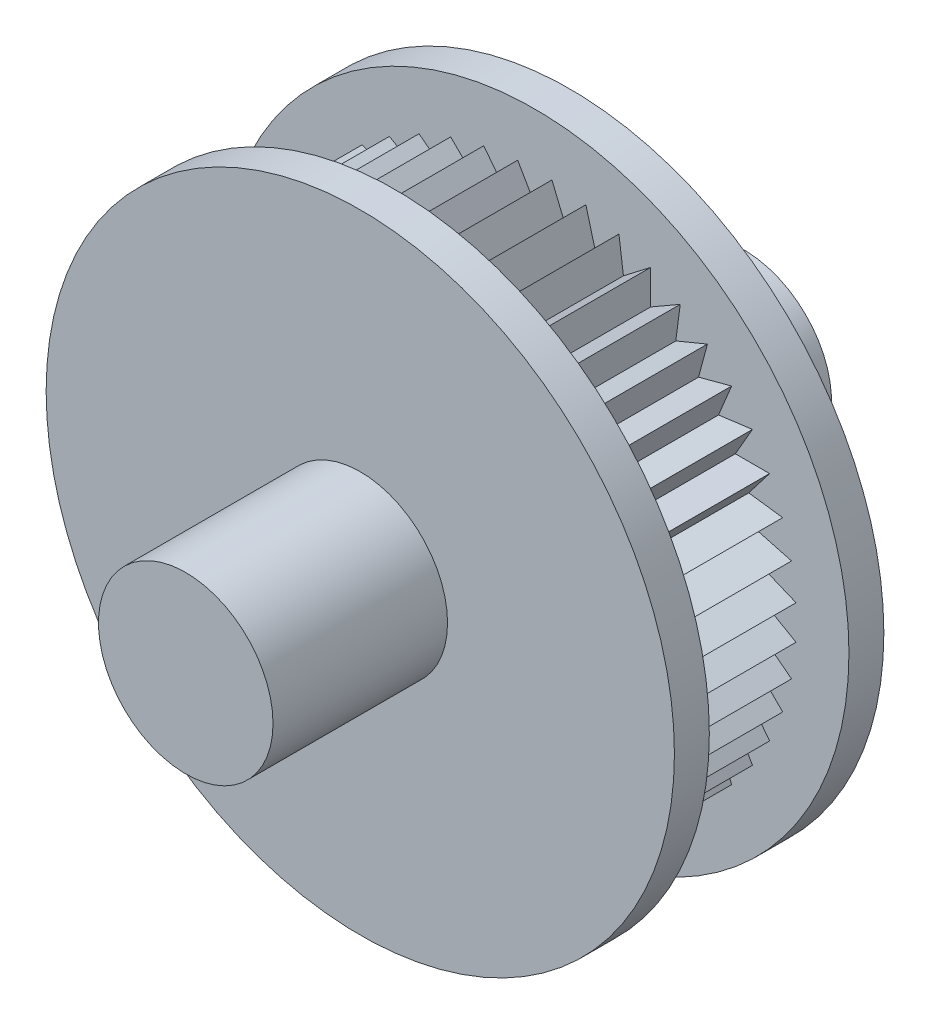
from build123d import *

# Parameters (mm, degrees)
SALIENTE_EXTRUIR1_DEPTH      = 2
SALIENTE_EXTRUIR1_DEPTH_BACK = 2
CROQUIS1_R                   = 7.5
CORTAR_EXTRUIR1_DEPTH        = 2.5
MATRIZC1_COUNT               = 48
CROQUIS3_R                   = 9
SALIENTE_EXTRUIR2_DEPTH      = 1
SALIENTE_EXTRUIR3_START      = 1
CROQUIS4_R                   = 9
SALIENTE_EXTRUIR3_DEPTH      = 1
CROQUIS5_R                   = 2.5
SALIENTE_EXTRUIR4_DEPTH      = 5
SALIENTE_EXTRUIR5_START      = 5
CROQUIS6_R                   = 2.5
SALIENTE_EXTRUIR5_DEPTH      = 5


with BuildPart() as part:
    # Croquis1 → Saliente-Extruir1 (new, two sides: drawn at the far end of the back side and taken through both)
    with BuildSketch(Plane.XY.offset(-SALIENTE_EXTRUIR1_DEPTH_BACK)):
        Circle(CROQUIS1_R)
    extrude(amount=SALIENTE_EXTRUIR1_DEPTH + SALIENTE_EXTRUIR1_DEPTH_BACK)

    # Croquis2 → Cortar-Extruir1 (cut, symmetric)
    with BuildSketch(Plane.XY):
        Polygon((-0.5, 7.5), (0.5, 7.5), (0, 6.633974596), align=None)
    cortar_extruir1 = extrude(amount=CORTAR_EXTRUIR1_DEPTH, both=True, mode=Mode.SUBTRACT)

    # MatrizC1: Cortar-Extruir1 ×48 about axis
    matrizc1_axis = Axis((0, 0, -2), (0, 0, 1))
    for i in range(1, MATRIZC1_COUNT):
        add(cortar_extruir1.rotate(matrizc1_axis, i * 360 / MATRIZC1_COUNT), mode=Mode.SUBTRACT)

    # Croquis3 → Saliente-Extruir2 (add)
    with BuildSketch(Plane.XY.offset(2)):
        Circle(CROQUIS3_R)
    extrude(amount=SALIENTE_EXTRUIR2_DEPTH)

    # Croquis4 → Saliente-Extruir3 (add)
    with BuildSketch(Plane(origin=(0, 0, -2), x_dir=(-1, 0, 0), z_dir=(0, 0, -1)).offset(SALIENTE_EXTRUIR3_START)):
        Circle(CROQUIS4_R)
    extrude(amount=-SALIENTE_EXTRUIR3_DEPTH)

    # Croquis5 → Saliente-Extruir4 (add)
    with BuildSketch(Plane.XY.offset(3)):
        Circle(CROQUIS5_R)
    extrude(amount=SALIENTE_EXTRUIR4_DEPTH)

    # Croquis6 → Saliente-Extruir5 (add)
    with BuildSketch(Plane(origin=(0, 0, -3), x_dir=(-1, 0, 0), z_dir=(0, 0, -1)).offset(SALIENTE_EXTRUIR5_START)):
        Circle(CROQUIS6_R)
    extrude(amount=-SALIENTE_EXTRUIR5_DEPTH)


solid = part.part
